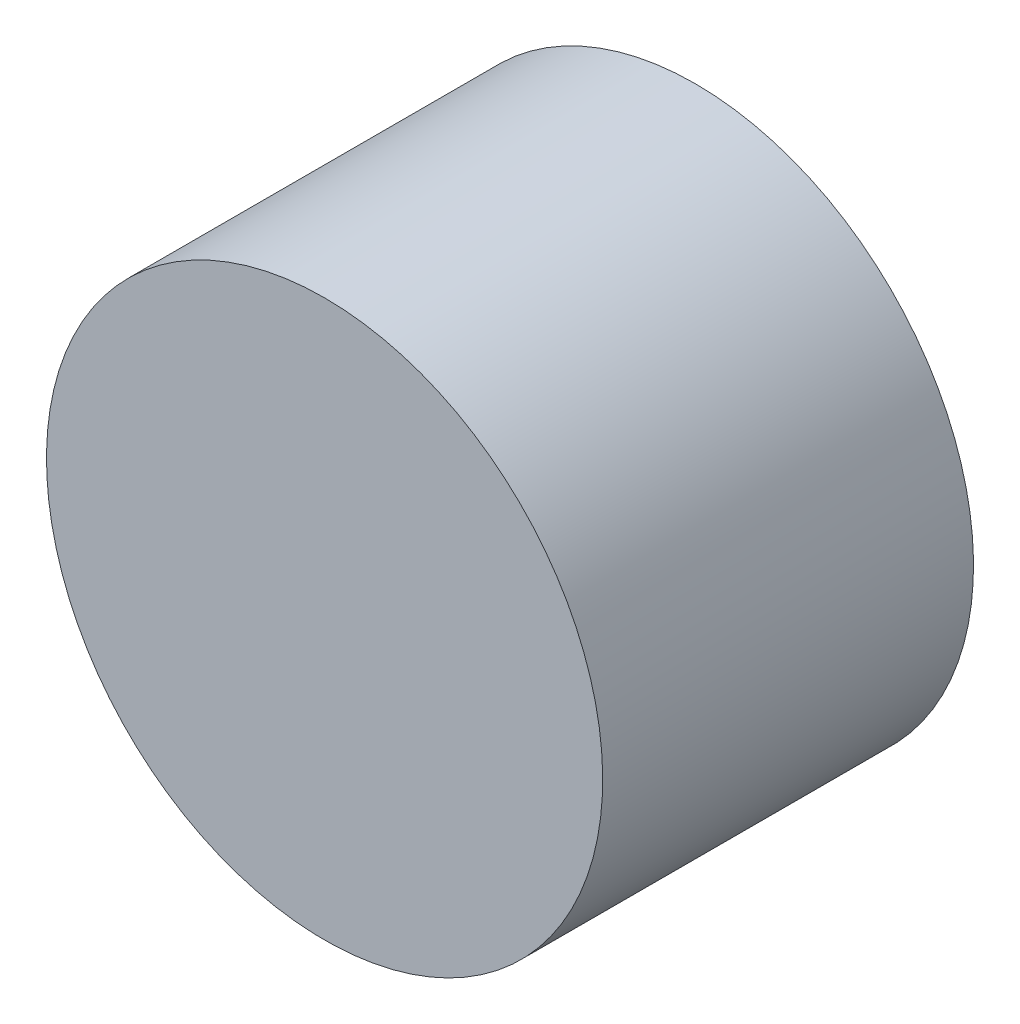
from build123d import *


with BuildPart() as part:
    # Esquisse1 → Révolution1 (revolve)
    with BuildSketch(Plane(origin=(0, 0, 0), x_dir=(0, 0, -1), z_dir=(1, 0, 0))):
        Polygon((-38, 0), (-38, 28.5), (0, 28.5), (0, 8), (-20, 8), (-20, 0), align=None)
    revolve(axis=Axis((0, 0, 20), (0, 0, 1)))


solid = part.part
